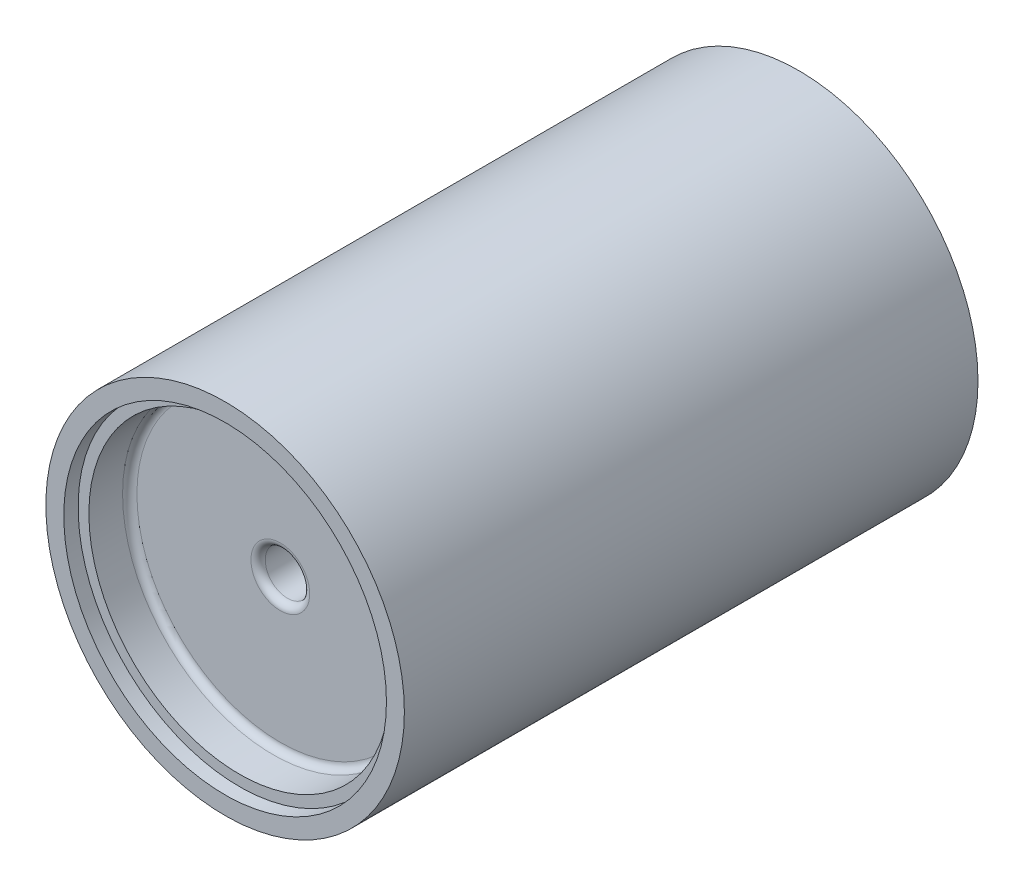
from build123d import *

# Parameters (mm, degrees)
ESBO_O1_R                = 25
ESBO_O1_R_2              = 3.1
RESSALTO_EXTRUS_O1_DEPTH = 40
ESBO_O3_R                = 21
CORTE_EXTRUS_O1_DEPTH    = 7.7
CORTE_EXTRUS_O2_START    = -7.7
ESBO_O4_R                = 21
CORTE_EXTRUS_O2_DEPTH    = 7.7
FILETE1_R                = 1
ESBO_O11_R               = 22.5
ESBO_O11_R_2             = 21
CORTE_EXTRUS_O3_DEPTH    = 2
CORTE_EXTRUS_O4_START    = -2
ESBO_O12_R               = 22.5
ESBO_O12_R_2             = 21
CORTE_EXTRUS_O4_DEPTH    = 2


with BuildPart() as part:
    # Esboço1 → Ressalto-extrusão1 (new, symmetric)
    with BuildSketch(Plane.XY):
        Circle(ESBO_O1_R)
        Circle(ESBO_O1_R_2, mode=Mode.SUBTRACT)
    extrude(amount=RESSALTO_EXTRUS_O1_DEPTH, both=True)

    # Esboço3 → Corte-extrusão1 (cut)
    with BuildSketch(Plane.XY.offset(40)):
        Circle(ESBO_O3_R)
    extrude(amount=-CORTE_EXTRUS_O1_DEPTH, mode=Mode.SUBTRACT)

    # Esboço4 → Corte-extrusão2 (cut)
    with BuildSketch(Plane(origin=(0, 0, -40), x_dir=(-1, 0, 0), z_dir=(0, 0, -1)).offset(CORTE_EXTRUS_O2_START)):
        with Locations(Location((0, 0, 0), (0, 0, 180))):
            Circle(ESBO_O4_R)
    extrude(amount=CORTE_EXTRUS_O2_DEPTH, mode=Mode.SUBTRACT)

    # Filete1
    filete1_edges = [part.edges().sort_by_distance(p)[0] for p in [
        (-21, 0, 32.3),
        (-3.1, 0, 32.3),
        (-21, 0, -32.3),
        (-3.1, 0, -32.3),
    ]]
    fillet(filete1_edges, radius=FILETE1_R)

    # Esboço11 → Corte-extrusão3 (cut)
    with BuildSketch(Plane.XY.offset(40)):
        Circle(ESBO_O11_R)
        Circle(ESBO_O11_R_2, mode=Mode.SUBTRACT)
    extrude(amount=-CORTE_EXTRUS_O3_DEPTH, mode=Mode.SUBTRACT)

    # Esboço12 → Corte-extrusão4 (cut)
    with BuildSketch(Plane(origin=(0, 0, -40), x_dir=(-1, 0, 0), z_dir=(0, 0, -1)).offset(CORTE_EXTRUS_O4_START)):
        with Locations(Location((0, 0, 0), (0, 0, 180))):
            Circle(ESBO_O12_R)
        Circle(ESBO_O12_R_2, mode=Mode.SUBTRACT)
    extrude(amount=CORTE_EXTRUS_O4_DEPTH, mode=Mode.SUBTRACT)


solid = part.part
